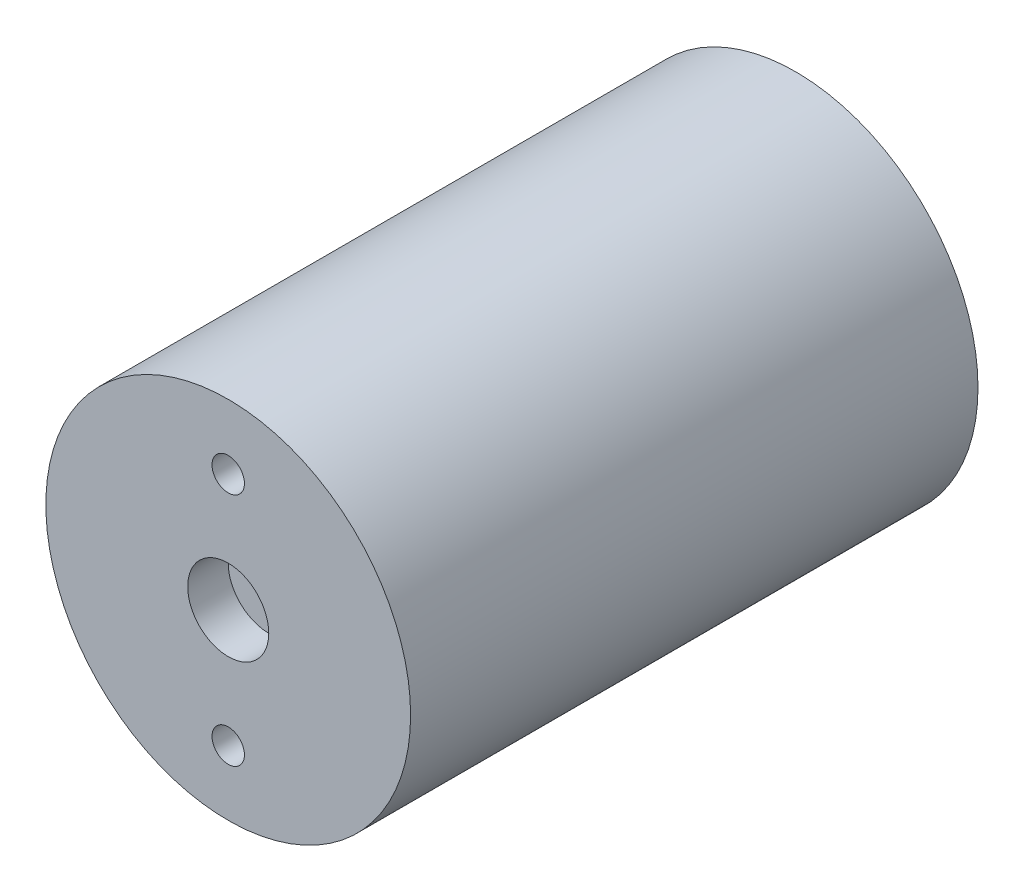
from build123d import *

# Parameters (mm, degrees)
SKETCH_1_R          = 22.5
EXTRUDE_1_DEPTH     = 70
SKETCH_2_R          = 2
CUT_EXTRUDE_1_DEPTH = 10
SKETCH_5_R          = 5
CUT_EXTRUDE_2_DEPTH = 5


with BuildPart() as part:
    # 草图1 → 凸台-拉伸1 (new body)
    with BuildSketch(Plane.XY):
        Circle(SKETCH_1_R)
    extrude(amount=EXTRUDE_1_DEPTH)

    # 草图2 → 切除-拉伸1 (cut)
    with BuildSketch(Plane.XY.offset(70)):
        with Locations((0, 14.5)):
            Circle(SKETCH_2_R)
        with Locations((0, -14.5)):
            Circle(SKETCH_2_R)
    extrude(amount=-CUT_EXTRUDE_1_DEPTH, mode=Mode.SUBTRACT)

    # 草图5 → 切除-拉伸2 (cut)
    with BuildSketch(Plane.XY.offset(70)):
        Circle(SKETCH_5_R)
    extrude(amount=-CUT_EXTRUDE_2_DEPTH, mode=Mode.SUBTRACT)


solid = part.part
